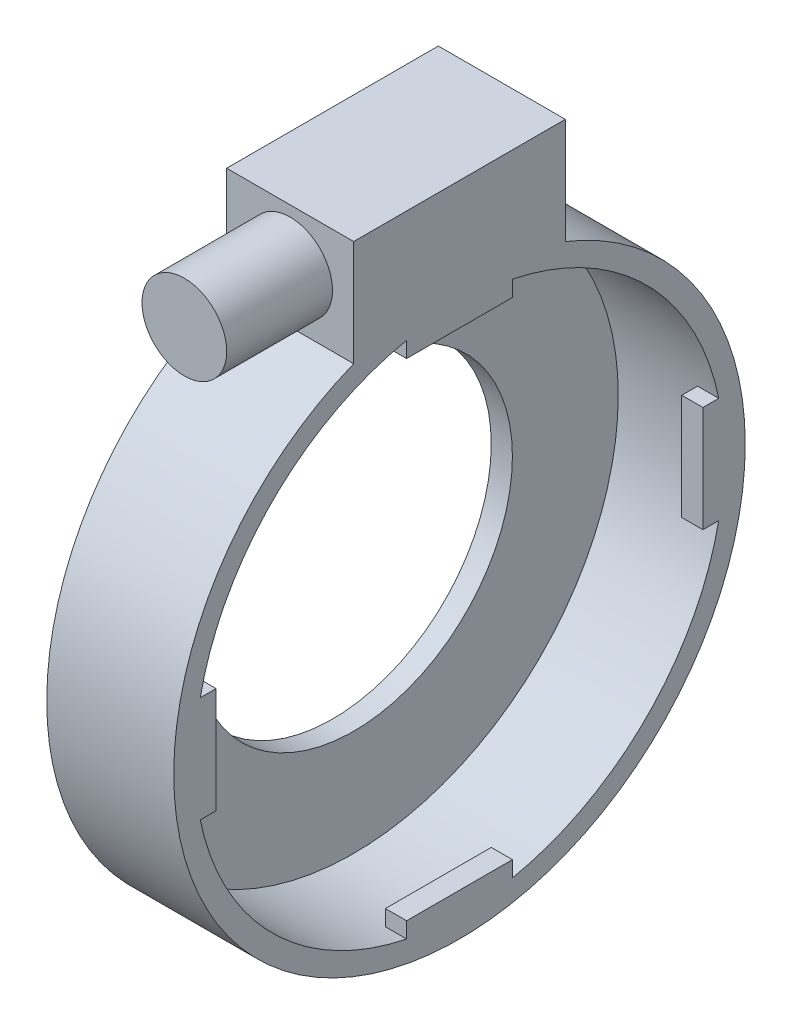
from build123d import *

# Parameters (mm, degrees)
SKETCH1_R           = 15
BOSS_EXTRUDE1_DEPTH = 12
SKETCH2_R           = 25
CUT_EXTRUDE1_DEPTH  = 10
SKETCH3_R           = 4
BOSS_EXTRUDE2_DEPTH = 10
BOSS_EXTRUDE3_DEPTH = 2


with BuildPart() as part:
    # Sketch1 → Boss-Extrude1 (new body)
    with BuildSketch(Plane(origin=(0, 0, 0), x_dir=(0, 0, -1), z_dir=(1, 0, 0))):
        with BuildLine():
            Line((-10, 25.079872408), (-10, 35.079872408))
            Line((-10, 35.079872408), (10, 35.079872408))
            Line((10, 35.079872408), (10, 25.079872408))
            ThreePointArc((10, 25.079872408), (0, -27), (-10, 25.079872408))
        make_face()
        Circle(SKETCH1_R, mode=Mode.SUBTRACT)
    extrude(amount=BOSS_EXTRUDE1_DEPTH)

    # Sketch2 → Cut-Extrude1 (cut)
    with BuildSketch(Plane(origin=(12, 0, 0), x_dir=(0, 0, -1), z_dir=(1, 0, 0))):
        Circle(SKETCH2_R)
    extrude(amount=-CUT_EXTRUDE1_DEPTH, mode=Mode.SUBTRACT)

    # Sketch3 → Boss-Extrude2 (add)
    with BuildSketch(Plane.XY.offset(10)):
        with Locations(Location((6, 30.079872408, 0), (0, 0, 180))):
            Circle(SKETCH3_R)
    extrude(amount=BOSS_EXTRUDE2_DEPTH)

    # Sketch4 → Boss-Extrude3 (add)
    with BuildSketch(Plane(origin=(12, 0, 0), x_dir=(0, 0, -1), z_dir=(1, 0, 0))):
        with BuildLine():
            Line((-23, 5), (-24.494897428, 5))
            ThreePointArc((-24.494897428, 5), (-25, 0), (-24.494897428, -5))
            Line((-24.494897428, -5), (-23, -5))
            Line((-23, -5), (-23, 5))
        make_face()
        with BuildLine():
            ThreePointArc((5, 24.494897428), (0, 25), (-5, 24.494897428))
            Line((-5, 24.494897428), (-5, 23))
            Line((-5, 23), (5, 23))
            Line((5, 23), (5, 24.494897428))
        make_face()
        with BuildLine():
            ThreePointArc((25, 0), (24.873403825, 2.51272405), (24.494897428, 5))
            Line((24.494897428, 5), (23, 5))
            Line((23, 5), (23, -5))
            Line((23, -5), (24.494897428, -5))
            ThreePointArc((24.494897428, -5), (24.873403825, -2.51272405), (25, 0))
        make_face()
        with BuildLine():
            Line((-5, -23), (-5, -24.494897428))
            ThreePointArc((-5, -24.494897428), (0, -25), (5, -24.494897428))
            Line((5, -24.494897428), (5, -23))
            Line((5, -23), (-5, -23))
        make_face()
    extrude(amount=-BOSS_EXTRUDE3_DEPTH)


solid = part.part
